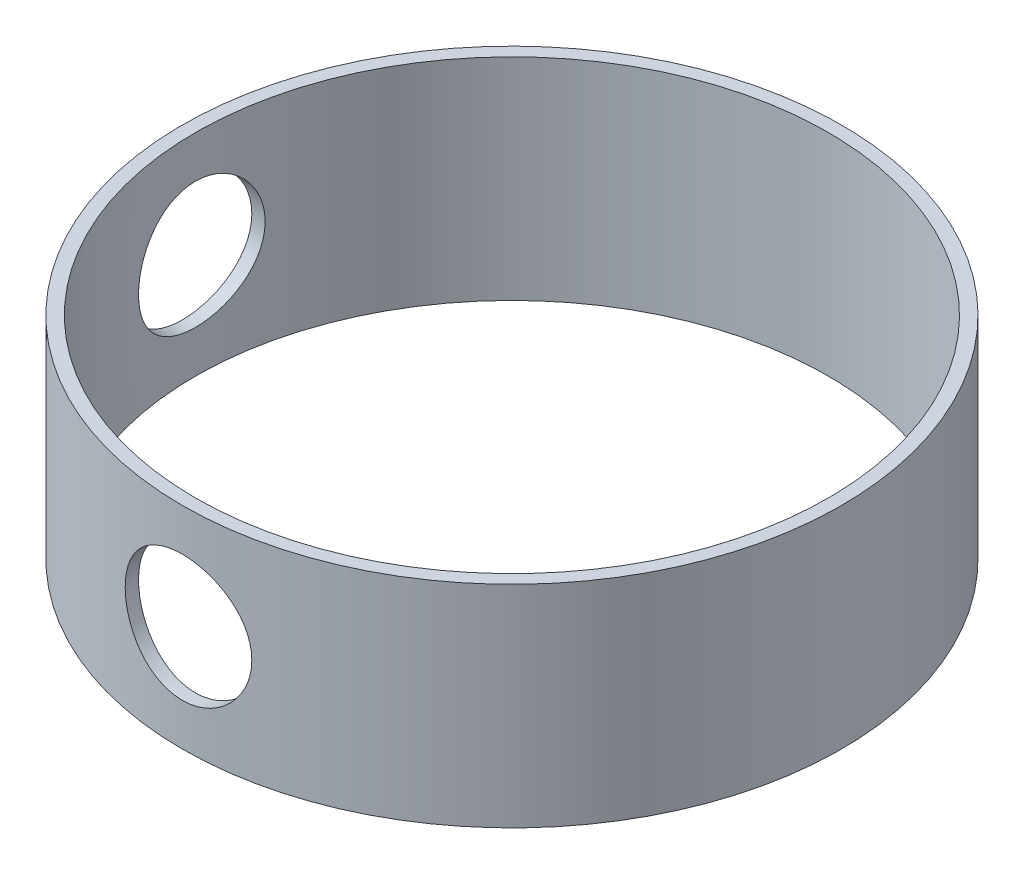
from build123d import *

# Parameters (mm, degrees)
SKETCH_1_R         = 39.6748
SKETCH_1_R_2       = 38.1
EXTRUDE_1_DEPTH    = 12.7
SKETCH2_R          = 7.62
CUT_EXTRUDE1_DEPTH = 65.468922824
CIRPATTERN1_COUNT  = 2
CIRPATTERN1_ANGLE  = 90


with BuildPart() as part:
    # 草图1 → 凸台-拉伸1 (new, symmetric)
    with BuildSketch(Plane(origin=(0, 0, 0), x_dir=(1, 0, 0), z_dir=(0, 1, 0))):
        with Locations(Location((0, 0, 0), (0, 0, 270))):
            Circle(SKETCH_1_R)
        with Locations(Location((0, 0, 0), (0, 0, 270))):
            Circle(SKETCH_1_R_2, mode=Mode.SUBTRACT)
    extrude(amount=EXTRUDE_1_DEPTH, both=True)

    # Sketch2 → Cut-Extrude1 (cut, through all)
    with BuildSketch(Plane(origin=(0, 19.05, 0), x_dir=(0, 0, -1), z_dir=(1, 0, 0))):
        with Locations((0, -19.05)):
            Circle(SKETCH2_R)
    cut_extrude1 = extrude(amount=-CUT_EXTRUDE1_DEPTH, mode=Mode.SUBTRACT)

    # CirPattern1: Cut-Extrude1 ×2 about axis
    cirpattern1_axis = Axis((0, -12.7, 0), (0, 1, 0))
    for i in range(1, CIRPATTERN1_COUNT):
        add(cut_extrude1.rotate(cirpattern1_axis, i * CIRPATTERN1_ANGLE / (CIRPATTERN1_COUNT - 1)), mode=Mode.SUBTRACT)


solid = part.part
